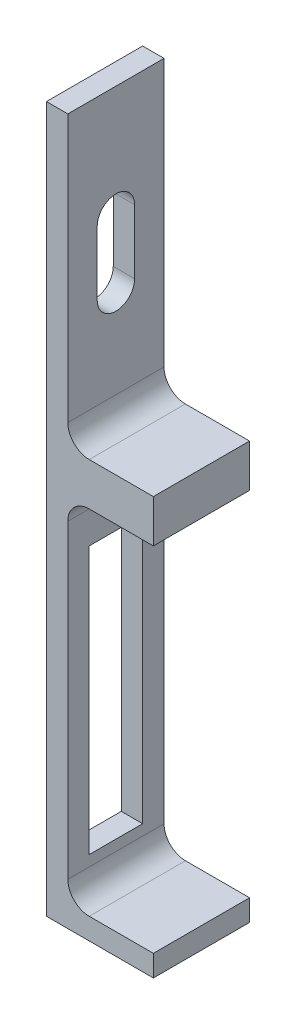
from build123d import *

# Parameters (mm, degrees)
EXTRUDE_1_DEPTH     = 9
CUT_EXTRUDE_2_DEPTH = 68.357256476
SKETCH_6_W          = 5
SKETCH_6_H          = 25
CUT_EXTRUDE_3_DEPTH = 68.089492471
FILLET_1_R          = 2
SKETCH_7_W          = 8
SKETCH_7_H          = 4
EXTRUDE_2_DEPTH     = 9
FILLET_2_R          = 2


with BuildPart() as part:
    # Эскиз1 → Бобышка-Вытянуть1 (new body)
    with BuildSketch(Plane.XY):
        Polygon((0, 0), (10, 0), (10, 2), (2, 2), (2, 66), (0, 66), align=None)
    extrude(amount=EXTRUDE_1_DEPTH)

    # Эскиз4 → Вырез-Вытянуть2 (cut, through all)
    with BuildSketch(Plane.ZY):
        with BuildLine():
            Line((6.25, 55.52), (6.25, 49.52))
            ThreePointArc((6.25, 49.52), (4.5, 47.77), (2.75, 49.52))
            Line((2.75, 49.52), (2.75, 55.52))
            ThreePointArc((2.75, 55.52), (4.5, 57.27), (6.25, 55.52))
        make_face()
    extrude(amount=-CUT_EXTRUDE_2_DEPTH, mode=Mode.SUBTRACT)

    # Эскиз6 → Вырез-Вытянуть3 (cut, through all)
    with BuildSketch(Plane(origin=(2, 0, 0), x_dir=(0, 0, -1), z_dir=(1, 0, 0))):
        with Locations((-4.5, 17.5)):
            Rectangle(SKETCH_6_W, SKETCH_6_H)
    extrude(amount=-CUT_EXTRUDE_3_DEPTH, mode=Mode.SUBTRACT)

    # Скругление1
    fillet_1_edges = [part.edges().sort_by_distance(p)[0] for p in [
        (2, 2, 4.5),
    ]]
    fillet(fillet_1_edges, radius=FILLET_1_R)

    # Эскиз7 → Бобышка-Вытянуть2 (add)
    with BuildSketch(Plane.XY.offset(9)):
        with Locations((6, 37)):
            Rectangle(SKETCH_7_W, SKETCH_7_H)
    extrude(amount=-EXTRUDE_2_DEPTH)

    # Скругление2
    fillet_2_edges = [part.edges().sort_by_distance(p)[0] for p in [
        (2, 39, 4.5),
        (2, 35, 4.5),
    ]]
    fillet(fillet_2_edges, radius=FILLET_2_R)


solid = part.part
